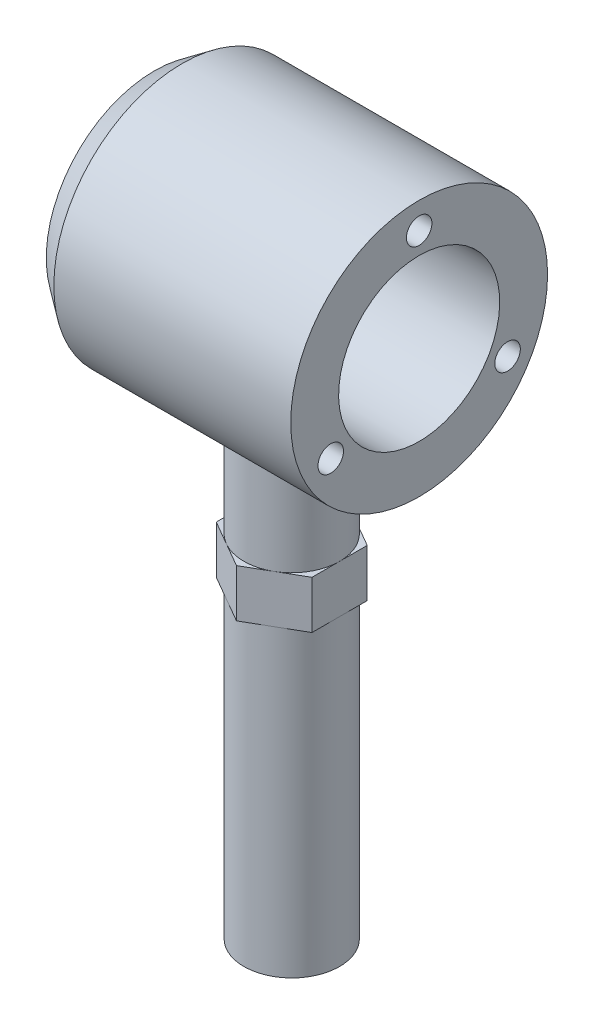
from build123d import *

# Parameters (mm, degrees)
SKETCH2_R                            = 15
BOSS_EXTRUDE1_DEPTH                  = 30
BOSS_EXTRUDE1_DIRECTION_2_REACH      = 123.644
BOSS_EXTRUDE1_DIRECTION_2_END_RADIUS = 40.25
BOSS_EXTRUDE2_DEPTH                  = 15
BOSS_EXTRUDE3_START                  = 95
SKETCH4_R                            = 15
BOSS_EXTRUDE3_DEPTH                  = 95
SKETCH5_R                            = 4
CUT_EXTRUDE1_DEPTH                   = 20


with BuildPart() as part:
    # Sketch1 → Revolve1 (revolve)
    with BuildSketch(Plane.XY):
        with BuildLine():
            Line((8.523453836, 15), (-1.164911567, 20.895027572))
            Line((-1.164911567, 20.895027572), (-1.164911567, 33.880431222))
            Line((-1.164911567, 33.880431222), (7.573302349, 40.25))
            Line((7.573302349, 40.25), (81.835088433, 40.25))
            Line((81.835088433, 40.25), (81.835088433, 25.25))
            Line((81.835088433, 25.25), (28.835088433, 25.25))
            ThreePointArc((28.835088433, 25.25), (17.45940164, 22.542321309), (8.523453836, 15))
        make_face()
    revolve(axis=Axis((28.835088433, 0, 0), (-1, 0, 0)))

    # Sketch2 → Boss-Extrude1 (add)
    with BuildSketch(Plane(origin=(0, -40.25, 0), x_dir=(-1, 0, 0), z_dir=(0, -1, 0))):
        with Locations(Location((-41.897124258, 0, 0), (0, 0, 90))):
            Circle(SKETCH2_R)
    extrude(amount=BOSS_EXTRUDE1_DEPTH)

    # Boss-Extrude1 direction 2: up to this cylinder (the profile starts outside it)
    boss_extrude1_direction_2_end = Plane(origin=(41.897124, 0, 0), z_dir=(1, 0, 0)) * Cylinder(BOSS_EXTRUDE1_DIRECTION_2_END_RADIUS, 328.788, mode=Mode.PRIVATE)
    # Sketch2 → Boss-Extrude1 direction 2 (add, up to the surface)
    with BuildSketch(Plane(origin=(0, -40.25, 0), x_dir=(-1, 0, 0), z_dir=(0, -1, 0)), mode=Mode.PRIVATE) as boss_extrude1_direction_2_sk1:
        with Locations(Location((-41.897124258, 0, 0), (0, 0, 90))):
            Circle(SKETCH2_R)
    boss_extrude1_direction_2_tool1 = extrude(boss_extrude1_direction_2_sk1.sketch, amount=-BOSS_EXTRUDE1_DIRECTION_2_REACH, mode=Mode.PRIVATE) - boss_extrude1_direction_2_end
    add(boss_extrude1_direction_2_tool1.solids().sort_by_distance((41.897124, -40.25, 0))[0])
    add(boss_extrude1_direction_2_tool1.solids().sort_by_distance((41.897124, -40.25, 0))[1])

    # Sketch3 → Boss-Extrude2 (add)
    with BuildSketch(Plane.XZ.offset(70.25)):
        Polygon((56.897124258, -8.660254038), (56.897124258, 8.660254038), (41.897124258, 17.320508076), (26.897124258, 8.660254038), (26.897124258, -8.660254038), (41.897124258, -17.320508076), align=None)
    extrude(amount=BOSS_EXTRUDE2_DEPTH)

    # Sketch4 → Boss-Extrude3 (add)
    with BuildSketch(Plane.XZ.offset(85.25).offset(BOSS_EXTRUDE3_START)):
        with Locations(Location((41.897124258, 0, 0), (0, 0, 120))):
            Circle(SKETCH4_R)
    extrude(amount=-BOSS_EXTRUDE3_DEPTH)

    # Sketch5 → Cut-Extrude1 (cut)
    with BuildSketch(Plane(origin=(81.835088433, 0, 0), x_dir=(0, 0, -1), z_dir=(1, 0, 0))):
        with Locations(Location((0, 32, 0), (0, 0, 90))):
            Circle(SKETCH5_R)
        with Locations(Location((27.712812921, -16, 0), (0, 0, 90))):
            Circle(SKETCH5_R)
        with Locations(Location((-27.712812921, -16, 0), (0, 0, 90))):
            Circle(SKETCH5_R)
    extrude(amount=-CUT_EXTRUDE1_DEPTH, mode=Mode.SUBTRACT)


solid = part.part
